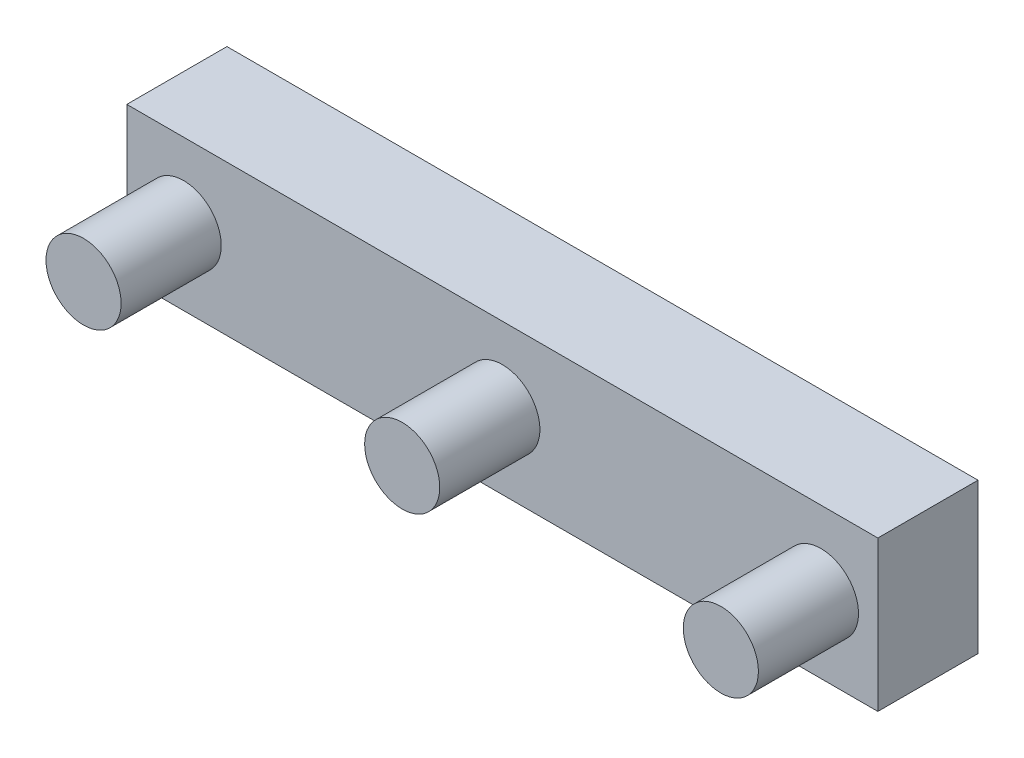
from build123d import *

# Parameters (mm, degrees)
SKETCH1_W           = 75
SKETCH1_H           = 15
BOSS_EXTRUDE1_DEPTH = 10
SKETCH2_R           = 3.75
BOSS_EXTRUDE2_DEPTH = 10


with BuildPart() as part:
    # Sketch1 → Boss-Extrude1 (new body)
    with BuildSketch(Plane.XY):
        Rectangle(SKETCH1_W, SKETCH1_H)
    extrude(amount=BOSS_EXTRUDE1_DEPTH)

    # Sketch2 → Boss-Extrude2 (add)
    with BuildSketch(Plane.XY.offset(10)):
        with Locations(Location((0, 0, 0), (0, 0, 180))):
            Circle(SKETCH2_R)
        with Locations(Location((-31.8197992, 0, 0), (0, 0, 180))):
            Circle(SKETCH2_R)
        with Locations(Location((31.8197992, 0, 0), (0, 0, 180))):
            Circle(SKETCH2_R)
    extrude(amount=BOSS_EXTRUDE2_DEPTH)


solid = part.part
